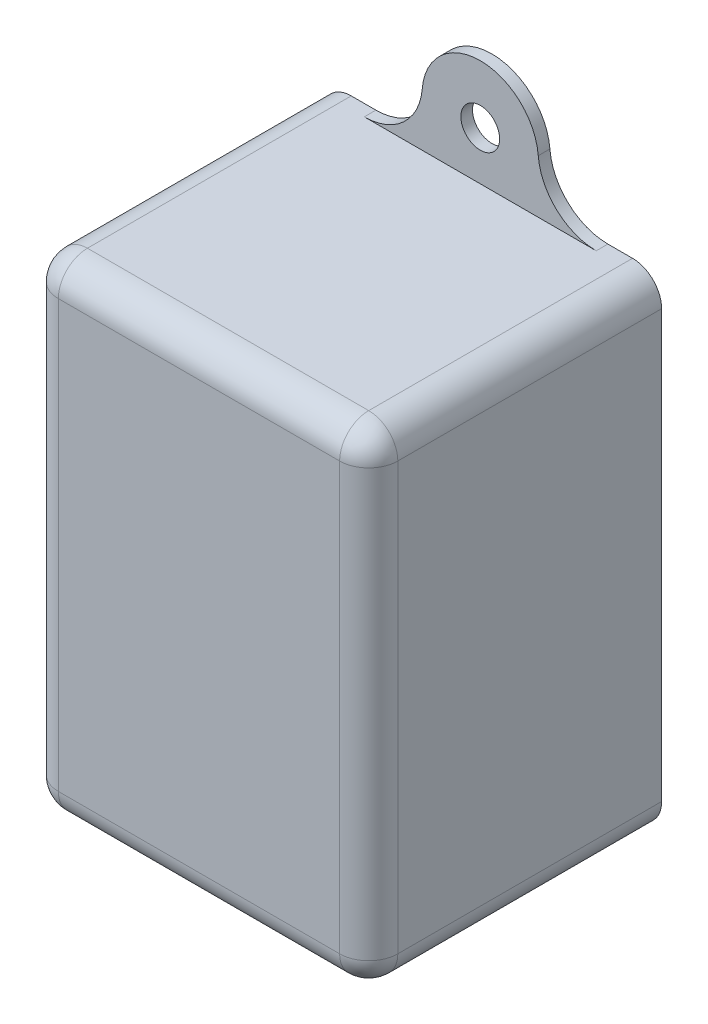
from build123d import *

# Parameters (mm, degrees)
SKETCH_1_R      = 2
EXTRUDE_1_DEPTH = 1.2
SKETCH_5_W      = 35
SKETCH_5_H      = 50
EXTRUDE_2_DEPTH = 29
FILLET_1_R      = 3


with BuildPart() as part:
    # 草图1 → 拉伸1 (new body)
    with BuildSketch(Plane.XY):
        with BuildLine():
            Line((-11.958260743, 25), (-17.5, 25))
            Line((-17.5, 25), (-17.5, -25))
            Line((-17.5, -25), (-11.958260743, -25))
            ThreePointArc((-11.958260743, -25), (-7.896241541, -26.584119567), (-5.979130372, -30.5))
            ThreePointArc((-5.979130372, -30.5), (0, -36), (5.979130372, -30.5))
            ThreePointArc((5.979130372, -30.5), (7.896241541, -26.584119567), (11.958260743, -25))
            Line((11.958260743, -25), (17.5, -25))
            Line((17.5, -25), (17.5, 25))
            Line((17.5, 25), (11.958260743, 25))
            ThreePointArc((11.958260743, 25), (7.896241541, 26.584119567), (5.979130372, 30.5))
            ThreePointArc((5.979130372, 30.5), (0, 36), (-5.979130372, 30.5))
            ThreePointArc((-5.979130372, 30.5), (-7.896241541, 26.584119567), (-11.958260743, 25))
        make_face()
        with Locations((0, 30)):
            Circle(SKETCH_1_R, mode=Mode.SUBTRACT)
        with Locations(Location((0, -30, 0), (0, 0, 180))):
            Circle(SKETCH_1_R, mode=Mode.SUBTRACT)
    extrude(amount=EXTRUDE_1_DEPTH)

    # 草图5 → 拉伸2 (add)
    with BuildSketch(Plane.XY.offset(1.2)):
        Rectangle(SKETCH_5_W, SKETCH_5_H)
    extrude(amount=EXTRUDE_2_DEPTH)

    # 圆角1
    fillet_1_edges = [part.edges().sort_by_distance(p)[0] for p in [
        (17.5, 25, 15.1),
        (17.5, -25, 15.1),
        (-17.5, -25, 15.1),
        (-17.5, 25, 15.1),
        (-17.5, 0, 30.2),
        (0, -25, 30.2),
        (17.5, 0, 30.2),
        (0, 25, 30.2),
    ]]
    fillet(fillet_1_edges, radius=FILLET_1_R)


solid = part.part
